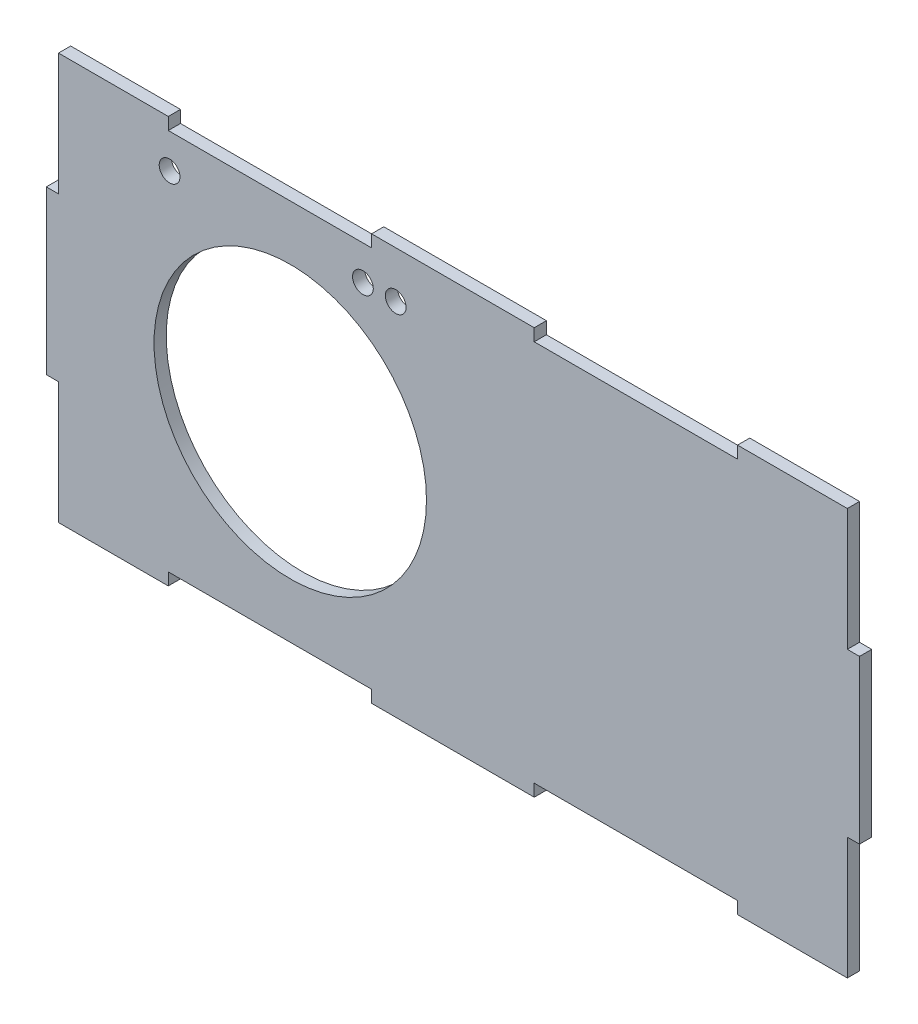
from build123d import *

# Parameters (mm, degrees)
ESQUISSE2_R             = 33.5
BOSS_EXTRU_1_DEPTH      = 3
ENL_V_MAT_EXTRU_1_REACH = 174.782
ESQUISSE3_R             = 2.55


with BuildPart() as part:
    # Esquisse2 → Boss.-Extru.1 (new body)
    with BuildSketch(Plane.XY):
        Polygon((26.963895135, 9.191113465), (66.963895135, 9.191113465), (66.963895135, 6.191113465), (116.963895135, 6.191113465), (116.963895135, 9.191113465), (143.963895135, 9.191113465), (143.963895135, -20.808886535), (146.963895135, -20.808886535), (146.963895135, -60.808886535), (143.963895135, -60.808886535), (143.963895135, -90.808886535), (116.963895135, -90.808886535), (116.963895135, -87.808886535), (66.963895135, -87.808886535), (66.963895135, -90.808886535), (26.963895135, -90.808886535), (26.963895135, -87.808886535), (-23.036104865, -87.808886535), (-23.036104865, -90.808886535), (-50.036104865, -90.808886535), (-50.036104865, -60.808886535), (-53.036104865, -60.808886535), (-53.036104865, -20.808886535), (-50.036104865, -20.808886535), (-50.036104865, 9.191113465), (-23.036104865, 9.191113465), (-23.036104865, 6.191113465), (26.963895135, 6.191113465), align=None)
        with Locations((6.963895135, -40.808886535)):
            Circle(ESQUISSE2_R, mode=Mode.SUBTRACT)
    extrude(amount=BOSS_EXTRU_1_DEPTH)

    # Esquisse3 → Enlèv. mat.-Extru.1 (cut, up to next)
    with BuildSketch(Plane.XY.offset(3), mode=Mode.PRIVATE) as enl_v_mat_extru_1_sk1:
        with Locations((24.835002906, -2.259814335)):
            Circle(ESQUISSE3_R)
    enl_v_mat_extru_1_tool1 = extrude(enl_v_mat_extru_1_sk1.sketch, amount=-ENL_V_MAT_EXTRU_1_REACH, mode=Mode.PRIVATE) & part.part
    # Esquisse3 → Enlèv. mat.-Extru.1 (cut, up to next)
    with BuildSketch(Plane.XY.offset(3), mode=Mode.PRIVATE) as enl_v_mat_extru_1_sk2:
        with Locations((32.903794199, -2.259814335)):
            Circle(ESQUISSE3_R)
    enl_v_mat_extru_1_tool2 = extrude(enl_v_mat_extru_1_sk2.sketch, amount=-ENL_V_MAT_EXTRU_1_REACH, mode=Mode.PRIVATE) & part.part
    # Esquisse3 → Enlèv. mat.-Extru.1 (cut, up to next)
    with BuildSketch(Plane.XY.offset(3), mode=Mode.PRIVATE) as enl_v_mat_extru_1_sk3:
        with Locations((-22.713231498, -2.259814335)):
            Circle(ESQUISSE3_R)
    enl_v_mat_extru_1_tool3 = extrude(enl_v_mat_extru_1_sk3.sketch, amount=-ENL_V_MAT_EXTRU_1_REACH, mode=Mode.PRIVATE) & part.part
    add(enl_v_mat_extru_1_tool1.solids().sort_by_distance((24.835003, -2.259814, 3))[0], mode=Mode.SUBTRACT)
    add(enl_v_mat_extru_1_tool2.solids().sort_by_distance((32.903794, -2.259814, 3))[0], mode=Mode.SUBTRACT)
    add(enl_v_mat_extru_1_tool3.solids().sort_by_distance((-22.713231, -2.259814, 3))[0], mode=Mode.SUBTRACT)


solid = part.part
